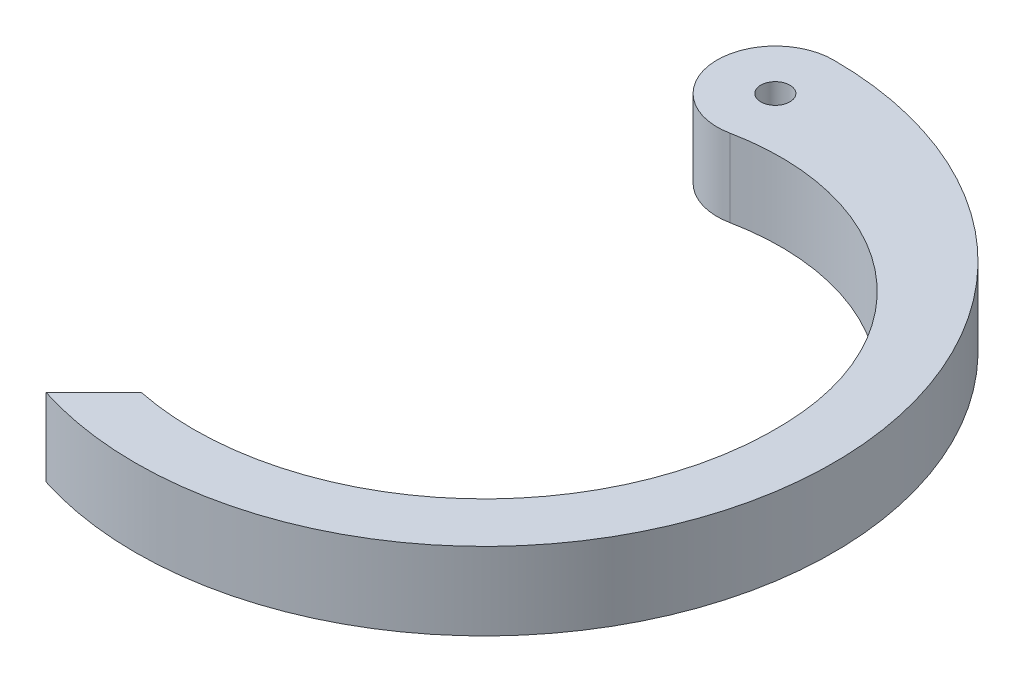
from build123d import *

# Parameters (mm, degrees)
SKETCH1_R           = 2.38125
BOSS_EXTRUDE1_DEPTH = 12.7


with BuildPart() as part:
    # Sketch1 → Boss-Extrude1 (new body)
    with BuildSketch(Plane(origin=(0, 0, 0), x_dir=(1, 0, 0), z_dir=(0, 1, 0))):
        with BuildLine():
            Line((-17.323415526, -102.086195126), (-9.525, -94.2877796))
            ThreePointArc((-9.525, -94.2877796), (31.929749665, -82.960983237), (47.386276692, -42.8625))
            ThreePointArc((47.386276692, -42.8625), (32.081828327, -16.002591621), (1.895451068, -9.3345))
            ThreePointArc((1.895451068, -9.3345), (-9.477255338, -0.9525), (0, 9.525))
            ThreePointArc((0, 9.525), (56.473798356, -56.390420656), (-17.323415526, -102.086195126))
        make_face()
        with Locations(Location((0, 0, 0), (0, 0, 270))):
            Circle(SKETCH1_R, mode=Mode.SUBTRACT)
    extrude(amount=BOSS_EXTRUDE1_DEPTH)


solid = part.part
